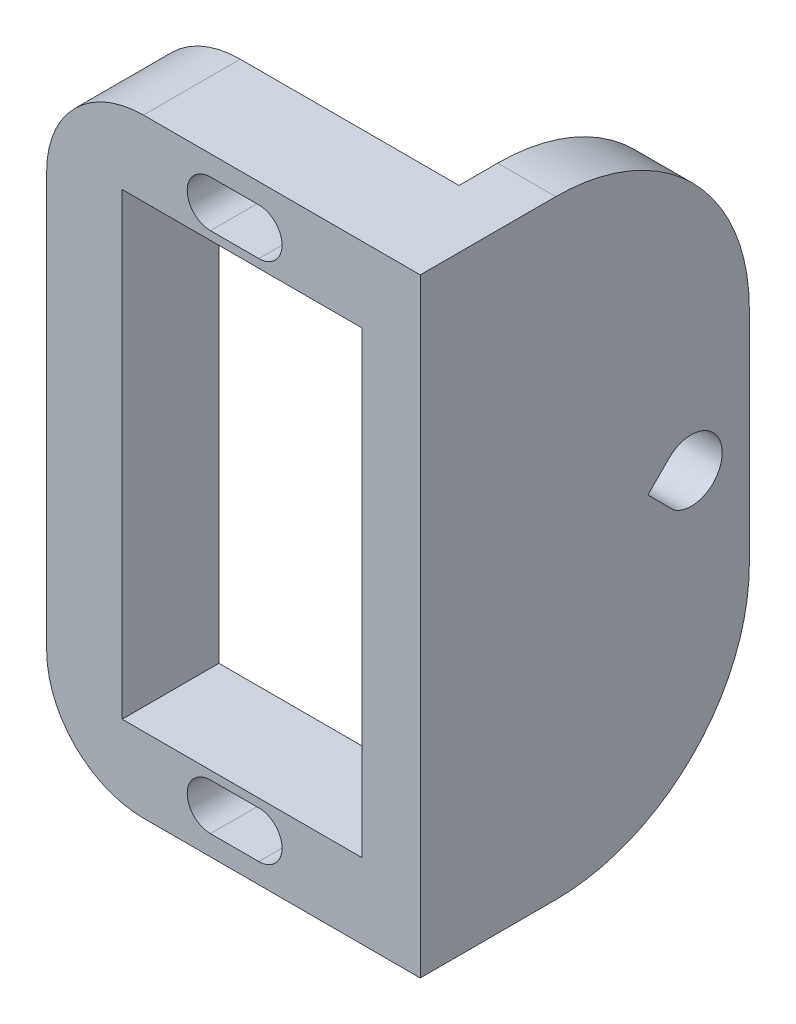
from build123d import *

# Parameters (mm, degrees)
BOSS_EXTRUDE2_DEPTH = 5
CUT_EXTRUDE1_DEPTH  = 23.574164436
SKETCH3_W           = 3
SKETCH3_H           = 3.88
BOSS_EXTRUDE3_DEPTH = 12
BOSS_EXTRUDE4_REACH = 35.791
SKETCH4_W           = 3
SKETCH4_H           = 6.078503162
SKETCH6_W           = 3
SKETCH6_H           = 23.7
BOSS_EXTRUDE5_DEPTH = 10.921497
CUT_EXTRUDE2_DEPTH  = 26.634408517
FILLET1_R           = 10
FILLET2_R           = 5


with BuildPart() as part:
    # Sketch1 → Boss-Extrude2 (new body)
    with BuildSketch(Plane(origin=(0, 0, 0), x_dir=(0, 1, 0), z_dir=(0, 0, 1))):
        Polygon((-11.85, 0), (11.85, 0), (11.85, -12.4), (11.85, -15.4), (15.73, -15.4), (15.73, -12.4), (15.73, -0.1), (15.73, 3.9), (-15.73, 3.9), (-15.73, -0.1), (-15.73, -12.4), (-15.73, -15.4), (-11.85, -15.4), (-11.85, -12.4), align=None)
    extrude(amount=BOSS_EXTRUDE2_DEPTH)

    # Sketch2 → Cut-Extrude1 (cut, through all)
    with BuildSketch(Plane.XY.offset(5)):
        with BuildLine():
            Line((4.56, -12.29), (7.06, -12.29))
            ThreePointArc((7.06, -12.29), (8.26, -13.49), (7.06, -14.69))
            Line((7.06, -14.69), (4.56, -14.69))
            ThreePointArc((4.56, -14.69), (3.36, -13.49), (4.56, -12.29))
        make_face()
        with BuildLine():
            Line((4.56, 12.29), (7.06, 12.29))
            ThreePointArc((7.06, 12.29), (8.26, 13.49), (7.06, 14.69))
            Line((7.06, 14.69), (4.56, 14.69))
            ThreePointArc((4.56, 14.69), (3.36, 13.49), (4.56, 12.29))
        make_face()
    extrude(amount=-CUT_EXTRUDE1_DEPTH, mode=Mode.SUBTRACT)

    # Sketch3 → Boss-Extrude3 (add)
    with BuildSketch(Plane(origin=(0, 0, 0), x_dir=(1, 0, 0), z_dir=(0, 0, -1))):
        with Locations((13.9, -13.79)):
            Rectangle(SKETCH3_W, SKETCH3_H)
        with Locations((13.9, 13.79)):
            Rectangle(SKETCH3_W, SKETCH3_H)
    extrude(amount=BOSS_EXTRUDE3_DEPTH)

    # Sketch4 → Boss-Extrude4 (add, up to next)
    with BuildSketch(Plane(origin=(0, -11.85, 0), x_dir=(-1, 0, 0), z_dir=(0, 1, 0)), mode=Mode.PRIVATE) as boss_extrude4_sk1:
        with Locations((-13.9, -8.960748419)):
            Rectangle(SKETCH4_W, SKETCH4_H)
    boss_extrude4_tool1 = extrude(boss_extrude4_sk1.sketch, amount=BOSS_EXTRUDE4_REACH, mode=Mode.PRIVATE) - part.part
    add(boss_extrude4_tool1.solids().sort_by_distance((13.9, -11.85, -8.960748))[0])

    # Sketch6 → Boss-Extrude5 (add)
    with BuildSketch(Plane.XY.offset(-5.921496838)):
        with Locations((13.9, 0)):
            Rectangle(SKETCH6_W, SKETCH6_H)
    extrude(amount=BOSS_EXTRUDE5_DEPTH)

    # Sketch5 → Cut-Extrude2 (cut, through all)
    with BuildSketch(Plane(origin=(12.4, 0, 0), x_dir=(0, -1, 0), z_dir=(-1, 0, 0))):
        with BuildLine():
            Line((0, -6.759630835), (-1.108998315, -7.86862915))
            ThreePointArc((-1.108998315, -7.86862915), (-0.136723769, -10.592070465), (1.355251929, -8.114882764))
            Line((1.355251929, -8.114882764), (0, -6.759630835))
        make_face()
    extrude(amount=-CUT_EXTRUDE2_DEPTH, mode=Mode.SUBTRACT)

    # Fillet1
    fillet1_edges = [part.edges().sort_by_distance(p)[0] for p in [
        (13.9, 15.73, -12),
        (13.9, -15.73, -12),
    ]]
    fillet(fillet1_edges, radius=FILLET1_R)

    # Fillet2
    fillet2_edges = [part.edges().sort_by_distance(p)[0] for p in [
        (-3.9, -15.73, 2.5),
        (-3.9, 15.73, 2.5),
    ]]
    fillet(fillet2_edges, radius=FILLET2_R)


solid = part.part
